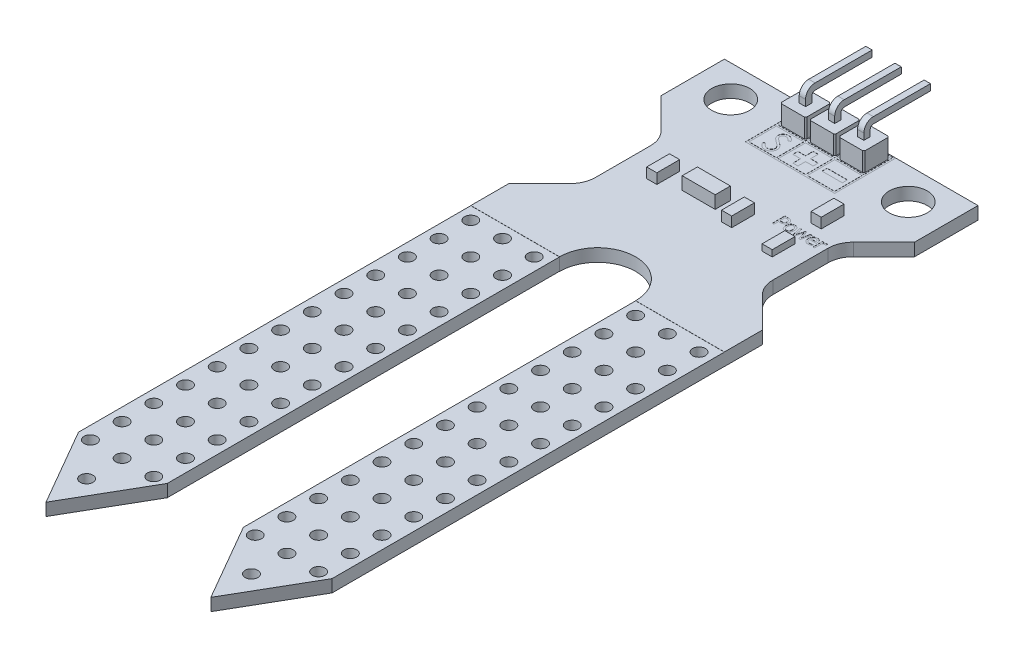
from build123d import *

# Parameters (mm, degrees)
BASE_DEPTH           = 0.5
HOLES_REACH          = 24.383
SKETCH2_R            = 1.5
PLATE_DEPTH          = 0.49
SKETCH4_R            = 0.5
PLATE_HOLES_DEPTH    = 58.879012604
SOCKET_DEPTH         = 1.5
POWER_PIN_DEPTH      = 0.25
LPATTERN2_COUNT      = 2
LPATTERN2_PITCH      = 2.3
LPATTERN2_COL_COUNT  = 2
LPATTERN2_COL_PITCH  = 2.3
SKETCH9_W            = 7.04
SKETCH9_H            = 4.74
SKETCH9_W_2          = 2.16
SKETCH9_H_2          = 2.16
SKETCH9_W_3          = 1.6
SKETCH9_H_3          = 0.4
CUT_EXTRUDE3_DEPTH   = 0.01
SKETCH10_W           = 2.6
SKETCH10_H           = 1.2
BIG_RESISTOR_DEPTH   = 1
SKETCH11_W           = 0.8
SKETCH11_H           = 1.8
SMALL_RESISTOR_DEPTH = 0.8
SKETCH12_W           = 0.8
SKETCH12_H           = 1.8
LIGHT_DEPTH          = 0.5


with BuildPart() as part:
    # Sketch1 → Base (new, symmetric)
    with BuildSketch(Plane(origin=(0, 0, 0), x_dir=(1, 0, 0), z_dir=(0, 1, 0))):
        with BuildLine():
            Line((-10, 0), (10, 0))
            Line((10, 0), (10, -5))
            Line((10, -5), (7.585786438, -7.414213562))
            ThreePointArc((7.585786438, -7.414213562), (7.152240935, -8.06306026), (7, -8.828427125))
            Line((7, -8.828427125), (7, -13.171572875))
            ThreePointArc((7, -13.171572875), (7.152240935, -13.93693974), (7.585786438, -14.585786438))
            Line((7.585786438, -14.585786438), (10, -17))
            Line((10, -17), (10, -20))
            Line((10, -20), (3, -20))
            ThreePointArc((3, -20), (0, -17), (-3, -20))
            Line((-3, -20), (-10, -20))
            Line((-10, -20), (-10, -17))
            Line((-10, -17), (-7.585786438, -14.585786438))
            ThreePointArc((-7.585786438, -14.585786438), (-7.152240935, -13.93693974), (-7, -13.171572875))
            Line((-7, -13.171572875), (-7, -8.828427125))
            ThreePointArc((-7, -8.828427125), (-7.152240935, -8.06306026), (-7.585786438, -7.414213562))
            Line((-7.585786438, -7.414213562), (-10, -5))
            Line((-10, -5), (-10, 0))
        make_face()
    extrude(amount=BASE_DEPTH, both=True)

    # Sketch2 → Holes (cut, up to next)
    with BuildSketch(Plane(origin=(0, 0.5, 0), x_dir=(1, 0, 0), z_dir=(0, 1, 0)), mode=Mode.PRIVATE) as holes_sk1:
        with Locations(Location((-7, -2.5, 0), (0, 0, 270))):
            Circle(SKETCH2_R)
    holes_tool1 = extrude(holes_sk1.sketch, amount=-HOLES_REACH, mode=Mode.PRIVATE) & part.part
    # Sketch2 → Holes (cut, up to next)
    with BuildSketch(Plane(origin=(0, 0.5, 0), x_dir=(1, 0, 0), z_dir=(0, 1, 0)), mode=Mode.PRIVATE) as holes_sk2:
        with Locations(Location((7, -2.5, 0), (0, 0, 270))):
            Circle(SKETCH2_R)
    holes_tool2 = extrude(holes_sk2.sketch, amount=-HOLES_REACH, mode=Mode.PRIVATE) & part.part
    add(holes_tool1.solids().sort_by_distance((-7, 0.5, 2.5))[0], mode=Mode.SUBTRACT)
    add(holes_tool2.solids().sort_by_distance((7, 0.5, 2.5))[0], mode=Mode.SUBTRACT)

    # Sketch3 → Plate (add, symmetric)
    with BuildSketch(Plane(origin=(0, 0, 0), x_dir=(1, 0, 0), z_dir=(0, 1, 0))):
        Polygon((-10, -20), (-3, -20), (-3, -50.937822174), (-6.5, -57), (-10, -50.937822174), align=None)
        Polygon((3, -50.937822174), (3, -20), (10, -20), (10, -50.937822174), (6.5, -57), align=None)
    extrude(amount=PLATE_DEPTH, both=True)

    # Sketch4 → Plate holes (cut, through all)
    with BuildSketch(Plane(origin=(0, 0.49, 0), x_dir=(1, 0, 0), z_dir=(0, 1, 0))):
        with Locations(Location((-9, -21, 0), (0, 0, 270))):
            Circle(SKETCH4_R)
        with Locations(Location((-6.5, -21, 0), (0, 0, 270))):
            Circle(SKETCH4_R)
        with Locations(Location((-4, -21, 0), (0, 0, 270))):
            Circle(SKETCH4_R)
        with Locations(Location((-6.5, -23.5, 0), (0, 0, 270))):
            Circle(SKETCH4_R)
        with Locations(Location((-4, -23.5, 0), (0, 0, 270))):
            Circle(SKETCH4_R)
        with Locations(Location((-6.5, -26, 0), (0, 0, 270))):
            Circle(SKETCH4_R)
        with Locations(Location((-4, -26, 0), (0, 0, 270))):
            Circle(SKETCH4_R)
        with Locations(Location((-6.5, -28.5, 0), (0, 0, 270))):
            Circle(SKETCH4_R)
        with Locations(Location((-4, -28.5, 0), (0, 0, 270))):
            Circle(SKETCH4_R)
        with Locations(Location((-6.5, -31, 0), (0, 0, 270))):
            Circle(SKETCH4_R)
        with Locations(Location((-4, -31, 0), (0, 0, 270))):
            Circle(SKETCH4_R)
        with Locations(Location((-6.5, -33.5, 0), (0, 0, 270))):
            Circle(SKETCH4_R)
        with Locations(Location((-4, -33.5, 0), (0, 0, 270))):
            Circle(SKETCH4_R)
        with Locations(Location((-6.5, -36, 0), (0, 0, 270))):
            Circle(SKETCH4_R)
        with Locations(Location((-4, -36, 0), (0, 0, 270))):
            Circle(SKETCH4_R)
        with Locations(Location((-6.5, -38.5, 0), (0, 0, 270))):
            Circle(SKETCH4_R)
        with Locations(Location((-4, -38.5, 0), (0, 0, 270))):
            Circle(SKETCH4_R)
        with Locations(Location((-6.5, -41, 0), (0, 0, 270))):
            Circle(SKETCH4_R)
        with Locations(Location((-4, -41, 0), (0, 0, 270))):
            Circle(SKETCH4_R)
        with Locations(Location((-6.5, -43.5, 0), (0, 0, 270))):
            Circle(SKETCH4_R)
        with Locations(Location((-4, -43.5, 0), (0, 0, 270))):
            Circle(SKETCH4_R)
        with Locations(Location((-6.5, -46, 0), (0, 0, 270))):
            Circle(SKETCH4_R)
        with Locations(Location((-4, -46, 0), (0, 0, 270))):
            Circle(SKETCH4_R)
        with Locations(Location((-6.5, -48.5, 0), (0, 0, 270))):
            Circle(SKETCH4_R)
        with Locations(Location((-4, -48.5, 0), (0, 0, 270))):
            Circle(SKETCH4_R)
        with Locations(Location((-6.5, -51, 0), (0, 0, 270))):
            Circle(SKETCH4_R)
        with Locations(Location((-4, -51, 0), (0, 0, 270))):
            Circle(SKETCH4_R)
        with Locations(Location((-9, -23.5, 0), (0, 0, 270))):
            Circle(SKETCH4_R)
        with Locations(Location((-9, -26, 0), (0, 0, 270))):
            Circle(SKETCH4_R)
        with Locations(Location((-9, -28.5, 0), (0, 0, 270))):
            Circle(SKETCH4_R)
        with Locations(Location((-9, -31, 0), (0, 0, 270))):
            Circle(SKETCH4_R)
        with Locations(Location((-9, -33.5, 0), (0, 0, 270))):
            Circle(SKETCH4_R)
        with Locations(Location((-9, -36, 0), (0, 0, 270))):
            Circle(SKETCH4_R)
        with Locations(Location((-9, -38.5, 0), (0, 0, 270))):
            Circle(SKETCH4_R)
        with Locations(Location((-9, -41, 0), (0, 0, 270))):
            Circle(SKETCH4_R)
        with Locations(Location((-9, -43.5, 0), (0, 0, 270))):
            Circle(SKETCH4_R)
        with Locations(Location((-9, -46, 0), (0, 0, 270))):
            Circle(SKETCH4_R)
        with Locations(Location((-9, -48.5, 0), (0, 0, 270))):
            Circle(SKETCH4_R)
        with Locations(Location((-9, -51, 0), (0, 0, 270))):
            Circle(SKETCH4_R)
        with Locations(Location((-6.5, -53.8, 0), (0, 0, 270))):
            Circle(SKETCH4_R)
        with Locations(Location((6.5, -53.8, 0), (0, 0, 90))):
            Circle(SKETCH4_R)
        with Locations(Location((9, -51, 0), (0, 0, 90))):
            Circle(SKETCH4_R)
        with Locations(Location((9, -48.5, 0), (0, 0, 90))):
            Circle(SKETCH4_R)
        with Locations(Location((9, -46, 0), (0, 0, 90))):
            Circle(SKETCH4_R)
        with Locations(Location((9, -43.5, 0), (0, 0, 90))):
            Circle(SKETCH4_R)
        with Locations(Location((9, -41, 0), (0, 0, 90))):
            Circle(SKETCH4_R)
        with Locations(Location((9, -38.5, 0), (0, 0, 90))):
            Circle(SKETCH4_R)
        with Locations(Location((9, -36, 0), (0, 0, 90))):
            Circle(SKETCH4_R)
        with Locations(Location((9, -33.5, 0), (0, 0, 90))):
            Circle(SKETCH4_R)
        with Locations(Location((9, -31, 0), (0, 0, 90))):
            Circle(SKETCH4_R)
        with Locations(Location((9, -28.5, 0), (0, 0, 90))):
            Circle(SKETCH4_R)
        with Locations(Location((9, -26, 0), (0, 0, 90))):
            Circle(SKETCH4_R)
        with Locations(Location((9, -23.5, 0), (0, 0, 90))):
            Circle(SKETCH4_R)
        with Locations(Location((4, -51, 0), (0, 0, 90))):
            Circle(SKETCH4_R)
        with Locations(Location((6.5, -51, 0), (0, 0, 90))):
            Circle(SKETCH4_R)
        with Locations(Location((4, -48.5, 0), (0, 0, 90))):
            Circle(SKETCH4_R)
        with Locations(Location((6.5, -48.5, 0), (0, 0, 90))):
            Circle(SKETCH4_R)
        with Locations(Location((4, -46, 0), (0, 0, 90))):
            Circle(SKETCH4_R)
        with Locations(Location((6.5, -46, 0), (0, 0, 90))):
            Circle(SKETCH4_R)
        with Locations(Location((4, -43.5, 0), (0, 0, 90))):
            Circle(SKETCH4_R)
        with Locations(Location((6.5, -43.5, 0), (0, 0, 90))):
            Circle(SKETCH4_R)
        with Locations(Location((4, -41, 0), (0, 0, 90))):
            Circle(SKETCH4_R)
        with Locations(Location((6.5, -41, 0), (0, 0, 90))):
            Circle(SKETCH4_R)
        with Locations(Location((4, -38.5, 0), (0, 0, 90))):
            Circle(SKETCH4_R)
        with Locations(Location((6.5, -38.5, 0), (0, 0, 90))):
            Circle(SKETCH4_R)
        with Locations(Location((4, -36, 0), (0, 0, 90))):
            Circle(SKETCH4_R)
        with Locations(Location((6.5, -36, 0), (0, 0, 90))):
            Circle(SKETCH4_R)
        with Locations(Location((4, -33.5, 0), (0, 0, 90))):
            Circle(SKETCH4_R)
        with Locations(Location((6.5, -33.5, 0), (0, 0, 90))):
            Circle(SKETCH4_R)
        with Locations(Location((4, -31, 0), (0, 0, 90))):
            Circle(SKETCH4_R)
        with Locations(Location((6.5, -31, 0), (0, 0, 90))):
            Circle(SKETCH4_R)
        with Locations(Location((4, -28.5, 0), (0, 0, 90))):
            Circle(SKETCH4_R)
        with Locations(Location((6.5, -28.5, 0), (0, 0, 90))):
            Circle(SKETCH4_R)
        with Locations(Location((4, -26, 0), (0, 0, 90))):
            Circle(SKETCH4_R)
        with Locations(Location((6.5, -26, 0), (0, 0, 90))):
            Circle(SKETCH4_R)
        with Locations(Location((4, -23.5, 0), (0, 0, 90))):
            Circle(SKETCH4_R)
        with Locations(Location((6.5, -23.5, 0), (0, 0, 90))):
            Circle(SKETCH4_R)
        with Locations(Location((4, -21, 0), (0, 0, 90))):
            Circle(SKETCH4_R)
        with Locations(Location((6.5, -21, 0), (0, 0, 90))):
            Circle(SKETCH4_R)
        with Locations(Location((9, -21, 0), (0, 0, 90))):
            Circle(SKETCH4_R)
    extrude(amount=-PLATE_HOLES_DEPTH, mode=Mode.SUBTRACT)

    # Sketch5 → Socket (add)
    with BuildSketch(Plane(origin=(0, 0.5, 0), x_dir=(1, 0, 0), z_dir=(0, 1, 0))):
        Polygon((-3.2, -0.3), (-3.3, -0.4), (-3.3, -2.2), (-3.2, -2.3), (-1.4, -2.3), (-1.3, -2.2), (-1.3, -0.4), (-1.4, -0.3), align=None)
        Polygon((-0.9, -0.3), (-1, -0.4), (-1, -2.2), (-0.9, -2.3), (0.9, -2.3), (1, -2.2), (1, -0.4), (0.9, -0.3), align=None)
        Polygon((1.4, -0.3), (1.3, -0.4), (1.3, -2.2), (1.4, -2.3), (3.2, -2.3), (3.3, -2.2), (3.3, -0.4), (3.2, -0.3), align=None)
    extrude(amount=SOCKET_DEPTH)

    # Sketch7 → Power pin (add, symmetric)
    with BuildSketch(Plane(origin=(0, 0, 0), x_dir=(0, 0, -1), z_dir=(1, 0, 0))):
        with BuildLine():
            Line((-1.05, 2), (-1.05, 2.5))
            ThreePointArc((-1.05, 2.5), (-0.976776695, 2.676776695), (-0.8, 2.75))
            Line((-0.8, 2.75), (3.7, 2.75))
            Line((3.7, 2.75), (3.7, 3.25))
            Line((3.7, 3.25), (-0.8, 3.25))
            ThreePointArc((-0.8, 3.25), (-1.330330086, 3.030330086), (-1.55, 2.5))
            Line((-1.55, 2.5), (-1.55, 2))
            Line((-1.55, 2), (-1.05, 2))
        make_face()
    power_pin = extrude(amount=POWER_PIN_DEPTH, both=True)

    # LPattern2: Power pin ×2
    with Locations(*[(i * LPATTERN2_PITCH, 0, 0) for i in range(1, LPATTERN2_COUNT)]):
        add(power_pin)

    # LPattern2 col: Power pin ×2
    with Locations(*[(-i * LPATTERN2_COL_PITCH, 0, 0) for i in range(1, LPATTERN2_COL_COUNT)]):
        add(power_pin)

    # Sketch9 → Cut-Extrude3 (cut)
    # profile 1 of 9: a face of its own
    with BuildSketch(Plane(origin=(0, 0.5, 0), x_dir=(1, 0, 0), z_dir=(0, 1, 0))):
        with Locations((0, -2.45)):
            Rectangle(SKETCH9_W, SKETCH9_H)
        with Locations((-2.3, -3.6)):
            Rectangle(SKETCH9_W_2, SKETCH9_H_2, mode=Mode.SUBTRACT)
        with Locations((2.3, -3.6)):
            Rectangle(SKETCH9_W_2, SKETCH9_H_2, mode=Mode.SUBTRACT)
        with Locations((0, -3.6)):
            Rectangle(SKETCH9_W_2, SKETCH9_H_2, mode=Mode.SUBTRACT)
        with Locations((2.3, -1.3)):
            Rectangle(SKETCH9_W_2, SKETCH9_H_2, mode=Mode.SUBTRACT)
        with Locations((0, -1.3)):
            Rectangle(SKETCH9_W_2, SKETCH9_H_2, mode=Mode.SUBTRACT)
        with Locations((-2.3, -1.3)):
            Rectangle(SKETCH9_W_2, SKETCH9_H_2, mode=Mode.SUBTRACT)
    # profile 2 of 9: a face of its own
    with BuildSketch(Plane(origin=(0, 0.5, 0), x_dir=(1, 0, 0), z_dir=(0, 1, 0))):
        Polygon((0.2, -3.8), (0.2, -4.4), (-0.2, -4.4), (-0.2, -3.8), (-0.8, -3.8), (-0.8, -3.4), (-0.2, -3.4), (-0.2, -2.8), (0.2, -2.8), (0.2, -3.4), (0.8, -3.4), (0.8, -3.8), align=None)
    # profile 3 of 9: a face of its own
    with BuildSketch(Plane(origin=(0, 0.5, 0), x_dir=(1, 0, 0), z_dir=(0, 1, 0))):
        with Locations((2.3, -3.6)):
            Rectangle(SKETCH9_W_3, SKETCH9_H_3)
    # profile 4 of 9: a face of its own
    with BuildSketch(Plane(origin=(0, 0.5, 0), x_dir=(1, 0, 0), z_dir=(0, 1, 0))):
        with BuildLine():
            add(Edge.make_bspline(
                [(-2.246490385, -4.576153846), (-2.273532617, -4.576315645), (-2.313654059, -4.573047968), (-2.366227141, -4.564203593), (-2.404086372, -4.553842087), (-2.441134062, -4.54125028), (-2.477209816, -4.525751551), (-2.512330919, -4.507176722), (-2.546694255, -4.485939358), (-2.58021238, -4.461223914), (-2.612571051, -4.432437596), (-2.644831422, -4.400374008), (-2.676043505, -4.364163602), (-2.706829687, -4.324386751), (-2.747659195, -4.264495287), (-2.775757513, -4.216295891), (-2.793846154, -4.182764423)],
                knots=[0, 0, 0, 0, 0.11369606, 0.169177916, 0.224159217, 0.278719878, 0.333794217, 0.389241459, 0.445822073, 0.503704281, 0.564293892, 0.627975416, 0.69503826, 0.765372726, 0.839611443, 1, 1, 1, 1], degree=3))
            Line((-2.793846154, -4.182764423), (-2.641682692, -4.091538462))
            add(Edge.make_bspline(
                [(-2.641682692, -4.091538462), (-2.615333113, -4.137281357), (-2.573720129, -4.20142962), (-2.508305323, -4.274072684), (-2.459465517, -4.316713706), (-2.408925617, -4.350224043), (-2.339499767, -4.381822359), (-2.283518044, -4.391635907), (-2.246490385, -4.391538462)],
                knots=[0, 0, 0, 0, 0.3046461, 0.438546905, 0.562322299, 0.677432543, 0.786897393, 1, 1, 1, 1], degree=3))
            add(Edge.make_bspline(
                [(-2.246490385, -4.391538462), (-2.215186191, -4.391820786), (-2.168541844, -4.386320718), (-2.108627287, -4.368972193), (-2.066142471, -4.350573946), (-2.026493488, -4.32827934), (-1.991723956, -4.301359985), (-1.961667208, -4.271219408), (-1.937075124, -4.237593574), (-1.918227568, -4.20143252), (-1.898856875, -4.152032077), (-1.894321716, -4.112425622), (-1.893846154, -4.086490385)],
                knots=[0, 0, 0, 0, 0.180930311, 0.27008822, 0.360156133, 0.448342532, 0.532665842, 0.613833704, 0.693981527, 0.772715977, 0.849335172, 1, 1, 1, 1], degree=3))
            add(Edge.make_bspline(
                [(-1.893846154, -4.086490385), (-1.893676765, -4.055991813), (-1.905960341, -3.99236022), (-1.938768022, -3.936635259), (-1.958389423, -3.909807692)],
                knots=[0, 0, 0, 0, 0.477158319, 1, 1, 1, 1], degree=3))
            add(Edge.make_bspline(
                [(-1.958389423, -3.909807692), (-1.974979405, -3.887924698), (-2.003044983, -3.854740657), (-2.046593296, -3.812409427), (-2.084590972, -3.776886112), (-2.127862178, -3.740740402), (-2.193103704, -3.687488516), (-2.246255026, -3.649200638), (-2.282908654, -3.622788462)],
                knots=[0, 0, 0, 0, 0.189529918, 0.299197872, 0.418925887, 0.548376285, 0.68813637, 1, 1, 1, 1], degree=3))
            add(Edge.make_bspline(
                [(-2.282908654, -3.622788462), (-2.319332486, -3.597298459), (-2.370311348, -3.559474956), (-2.433967391, -3.510236121), (-2.473696699, -3.478200971), (-2.507834061, -3.449097245), (-2.543316445, -3.417339903), (-2.565438588, -3.393305532), (-2.577860577, -3.377956731)],
                knots=[0, 0, 0, 0, 0.347081672, 0.495567816, 0.628357302, 0.74551967, 0.845830751, 1, 1, 1, 1], degree=3))
            add(Edge.make_bspline(
                [(-2.577860577, -3.377956731), (-2.593776531, -3.357350823), (-2.615964811, -3.325716744), (-2.639676206, -3.280617496), (-2.653448515, -3.246424078), (-2.665023886, -3.21184492), (-2.675502407, -3.164553806), (-2.678598853, -3.128201284), (-2.678461538, -3.103918269)],
                knots=[0, 0, 0, 0, 0.262558979, 0.388264447, 0.512667355, 0.63372227, 0.75539386, 1, 1, 1, 1], degree=3))
            add(Edge.make_bspline(
                [(-2.678461538, -3.103918269), (-2.678553734, -3.066252593), (-2.671447507, -3.010220346), (-2.647478206, -2.939595989), (-2.62266971, -2.890054956), (-2.590643888, -2.84481532), (-2.55359371, -2.803356628), (-2.509461666, -2.768505533), (-2.461039929, -2.738048494), (-2.408041541, -2.714232988), (-2.333433939, -2.689984634), (-2.274246585, -2.68435437), (-2.234951923, -2.683846154)],
                knots=[0, 0, 0, 0, 0.165779888, 0.246280008, 0.327460928, 0.408796954, 0.489715241, 0.571376032, 0.655523321, 0.741019483, 0.826546761, 1, 1, 1, 1], degree=3))
            add(Edge.make_bspline(
                [(-2.234951923, -2.683846154), (-2.192822847, -2.683778289), (-2.129561237, -2.691525523), (-2.049769386, -2.719640703), (-2.001713874, -2.743365307), (-1.964102617, -2.767094216), (-1.935419451, -2.788703433), (-1.906353652, -2.813582569), (-1.876668732, -2.841794847), (-1.846876235, -2.873605751), (-1.805150747, -2.921908707), (-1.774984467, -2.960923517), (-1.755384615, -2.988533654)],
                knots=[0, 0, 0, 0, 0.213251813, 0.318830447, 0.426793531, 0.483645951, 0.543603822, 0.60830765, 0.67712676, 0.750685636, 0.828713418, 1, 1, 1, 1], degree=3))
            Line((-1.755384615, -2.988533654), (-1.901418269, -3.099230769))
            add(Edge.make_bspline(
                [(-1.901418269, -3.099230769), (-1.918152053, -3.077154577), (-1.943547889, -3.046203482), (-1.977300729, -3.007374607), (-2.001237063, -2.983063683), (-2.023554691, -2.961103375), (-2.045214679, -2.942300853), (-2.065906655, -2.92647406), (-2.091989734, -2.909580502), (-2.124758085, -2.892855124), (-2.179943857, -2.873750803), (-2.223743197, -2.868638568), (-2.252980769, -2.868461538)],
                knots=[0, 0, 0, 0, 0.189629101, 0.274184089, 0.352183161, 0.423198873, 0.488550946, 0.548473346, 0.601440164, 0.701198082, 0.799591802, 1, 1, 1, 1], degree=3))
            add(Edge.make_bspline(
                [(-2.252980769, -2.868461538), (-2.288760118, -2.86794829), (-2.341326045, -2.875600288), (-2.404161728, -2.904100386), (-2.443540668, -2.93303211), (-2.476282849, -2.967351191), (-2.508192012, -3.020207311), (-2.51686998, -3.066044557), (-2.516923077, -3.096346154)],
                knots=[0, 0, 0, 0, 0.275902964, 0.402370856, 0.528413645, 0.650356379, 0.765895086, 1, 1, 1, 1], degree=3))
            add(Edge.make_bspline(
                [(-2.516923077, -3.096346154), (-2.517539684, -3.115722128), (-2.513143133, -3.144479643), (-2.503403158, -3.182255061), (-2.491936029, -3.210503374), (-2.476063781, -3.239039588), (-2.446620415, -3.280532441), (-2.418546908, -3.309399632), (-2.398293269, -3.328918269)],
                knots=[0, 0, 0, 0, 0.214745861, 0.32293856, 0.434116163, 0.553412311, 0.686072985, 1, 1, 1, 1], degree=3))
            add(Edge.make_bspline(
                [(-2.398293269, -3.328918269), (-2.389042289, -3.337396199), (-2.372125001, -3.35132235), (-2.345275359, -3.371329108), (-2.31778666, -3.392209601), (-2.284886018, -3.416419074), (-2.230365405, -3.455214082), (-2.187146804, -3.486462007), (-2.156346154, -3.508125)],
                knots=[0, 0, 0, 0, 0.124951974, 0.218093899, 0.333502411, 0.468789179, 0.624937586, 1, 1, 1, 1], degree=3))
            add(Edge.make_bspline(
                [(-2.156346154, -3.508125), (-2.118469517, -3.535564261), (-2.063761069, -3.575795807), (-1.996356754, -3.63167221), (-1.952403412, -3.670950709), (-1.912867071, -3.708765499), (-1.878184215, -3.745569323), (-1.848004854, -3.781099122), (-1.815504812, -3.826650485), (-1.782356478, -3.882596668), (-1.744802823, -3.972233355), (-1.732343451, -4.042695168), (-1.732307692, -4.089014423)],
                knots=[0, 0, 0, 0, 0.187773439, 0.272396139, 0.351320997, 0.424334774, 0.491908784, 0.55423322, 0.611267658, 0.716347845, 0.814540086, 1, 1, 1, 1], degree=3))
            add(Edge.make_bspline(
                [(-1.732307692, -4.089014423), (-1.73180834, -4.121010342), (-1.737031862, -4.168370829), (-1.752300775, -4.229625604), (-1.76926769, -4.273294873), (-1.790011741, -4.315849132), (-1.816324044, -4.356173249), (-1.84682563, -4.395159376), (-1.881814286, -4.431768058), (-1.920100785, -4.46537458), (-1.960566684, -4.495269858), (-2.003278223, -4.520195214), (-2.048003875, -4.540540115), (-2.094753202, -4.556431906), (-2.160627295, -4.572091465), (-2.211953075, -4.576287109), (-2.246490385, -4.576153846)],
                knots=[0, 0, 0, 0, 0.121774528, 0.18091956, 0.240256115, 0.300114444, 0.361145948, 0.423500582, 0.488669361, 0.553954105, 0.617581261, 0.680238427, 0.742187389, 0.804663212, 0.868258989, 1, 1, 1, 1], degree=3))
        make_face()
    # profile 5 of 9: a face of its own
    with BuildSketch(Plane(origin=(0, 0.5, 0), x_dir=(1, 0, 0), z_dir=(0, 1, 0))):
        with BuildLine():
            add(Edge.make_bspline(
                [(3.614912975, -8.391520479), (3.633163899, -8.404040768), (3.658411823, -8.425948178), (3.685654097, -8.46087403), (3.703330738, -8.48928983), (3.717341928, -8.520703016), (3.730875146, -8.568320938), (3.734174902, -8.606496516), (3.734177215, -8.632620163)],
                knots=[0, 0, 0, 0, 0.236652735, 0.354095324, 0.472428991, 0.593574989, 0.720487505, 1, 1, 1, 1], degree=3))
            add(Edge.make_bspline(
                [(3.734177215, -8.632620163), (3.734440026, -8.65413018), (3.73119797, -8.686086104), (3.721473566, -8.727478688), (3.711089093, -8.757085204), (3.698453563, -8.785275409), (3.678015797, -8.819787273), (3.659487713, -8.843157966), (3.645371835, -8.856908137)],
                knots=[0, 0, 0, 0, 0.260381683, 0.387741643, 0.51462425, 0.640165698, 0.76161061, 1, 1, 1, 1], degree=3))
            add(Edge.make_bspline(
                [(3.645371835, -8.856908137), (3.628222596, -8.874168407), (3.59926142, -8.896823181), (3.556438332, -8.920876751), (3.521585919, -8.935975104), (3.483093971, -8.94749291), (3.423362636, -8.958938368), (3.375658725, -8.96133288), (3.342563291, -8.961338517)],
                knots=[0, 0, 0, 0, 0.221351823, 0.332954221, 0.446758858, 0.566651796, 0.698228055, 1, 1, 1, 1], degree=3))
            Line((3.342563291, -8.961338517), (3.227848101, -8.961338517))
            Line((3.227848101, -8.961338517), (3.227848101, -9.328427125))
            Line((3.227848101, -9.328427125), (3.101265823, -9.328427125))
            Line((3.101265823, -9.328427125), (3.101265823, -8.328427125))
            Line((3.101265823, -8.328427125), (3.353045886, -8.328427125))
            add(Edge.make_bspline(
                [(3.353045886, -8.328427125), (3.380558098, -8.328591969), (3.420312752, -8.329842529), (3.470780842, -8.336395884), (3.504037276, -8.342925648), (3.534802149, -8.351368673), (3.572563912, -8.365779841), (3.598766283, -8.380299011), (3.614912975, -8.391520479)],
                knots=[0, 0, 0, 0, 0.30181566, 0.435226341, 0.557564183, 0.673137959, 0.784559398, 1, 1, 1, 1], degree=3))
        make_face()
        with BuildLine():
            add(Edge.make_bspline(
                [(3.537381329, -8.786892315), (3.547149877, -8.777187217), (3.559916605, -8.76124491), (3.573428862, -8.738111904), (3.581476261, -8.720221024), (3.587667462, -8.701198951), (3.59357476, -8.673078574), (3.594986766, -8.650929826), (3.594936709, -8.63578472)],
                knots=[0, 0, 0, 0, 0.248145665, 0.366464644, 0.482520177, 0.601375968, 0.726646544, 1, 1, 1, 1], degree=3))
            add(Edge.make_bspline(
                [(3.594936709, -8.63578472), (3.594789738, -8.619309561), (3.593083931, -8.595126144), (3.585163427, -8.564773287), (3.577223407, -8.544346049), (3.566984326, -8.525610525), (3.549606752, -8.503120705), (3.533738054, -8.488717261), (3.521558544, -8.481116998)],
                knots=[0, 0, 0, 0, 0.276790802, 0.403639623, 0.524779878, 0.643555797, 0.76031789, 1, 1, 1, 1], degree=3))
            add(Edge.make_bspline(
                [(3.521558544, -8.481116998), (3.51078644, -8.473587721), (3.492737769, -8.464957834), (3.467187336, -8.455966479), (3.446090507, -8.450902768), (3.423168412, -8.446938897), (3.387698148, -8.443119788), (3.35971181, -8.442515837), (3.340189873, -8.442351175)],
                knots=[0, 0, 0, 0, 0.208675435, 0.31773578, 0.431465043, 0.554188898, 0.688523325, 1, 1, 1, 1], degree=3))
            Line((3.340189873, -8.442351175), (3.227848101, -8.442351175))
            Line((3.227848101, -8.442351175), (3.227848101, -8.847414467))
            Line((3.227848101, -8.847414467), (3.320213608, -8.847414467))
            add(Edge.make_bspline(
                [(3.320213608, -8.847414467), (3.345029006, -8.847498782), (3.38040532, -8.846178554), (3.424687105, -8.840438303), (3.452502513, -8.834843592), (3.477307912, -8.826876615), (3.50692572, -8.813034705), (3.5261344, -8.798096919), (3.537381329, -8.786892315)],
                knots=[0, 0, 0, 0, 0.321498886, 0.457598653, 0.578008104, 0.688449725, 0.794251854, 1, 1, 1, 1], degree=3))
        make_face(mode=Mode.SUBTRACT)
    # profile 6 of 9: a face of its own
    with BuildSketch(Plane(origin=(0, 0.5, 0), x_dir=(1, 0, 0), z_dir=(0, 1, 0))):
        with BuildLine():
            add(Edge.make_bspline(
                [(4.133504747, -8.556275226), (4.157708908, -8.556117091), (4.193387837, -8.559333154), (4.238959054, -8.570162328), (4.270538006, -8.581757766), (4.300148249, -8.596705447), (4.327974594, -8.614764037), (4.353885805, -8.636091391), (4.377594091, -8.660673718), (4.39895468, -8.68818389), (4.417660945, -8.718477693), (4.433484694, -8.751425611), (4.446381381, -8.787075761), (4.45617346, -8.825449966), (4.465823875, -8.881619317), (4.468470297, -8.925460695), (4.46835443, -8.955404973)],
                knots=[0, 0, 0, 0, 0.123251869, 0.181667577, 0.238204524, 0.294238286, 0.350327398, 0.406885296, 0.464849193, 0.523978139, 0.584011388, 0.645910249, 0.709879935, 0.776851044, 0.847428363, 1, 1, 1, 1], degree=3))
            add(Edge.make_bspline(
                [(4.46835443, -8.955404973), (4.468440132, -8.98547689), (4.465885837, -9.029395426), (4.456156814, -9.085623055), (4.446332938, -9.123978398), (4.433584947, -9.159691752), (4.417591758, -9.192561483), (4.399016176, -9.22280112), (4.377592314, -9.250149929), (4.353816579, -9.274513371), (4.328036623, -9.295873499), (4.300130224, -9.313699076), (4.270534065, -9.328478991), (4.238918768, -9.339808627), (4.193400942, -9.350723642), (4.157701972, -9.353881609), (4.133504747, -9.35374358)],
                knots=[0, 0, 0, 0, 0.153333766, 0.223622391, 0.290633759, 0.35495793, 0.416591386, 0.476660723, 0.53556016, 0.593317841, 0.649909737, 0.705850098, 0.76176723, 0.818223218, 0.876674041, 1, 1, 1, 1], degree=3))
            add(Edge.make_bspline(
                [(4.133504747, -9.35374358), (4.10862386, -9.35402896), (4.072151508, -9.35062251), (4.025572771, -9.339483559), (3.99360707, -9.32744457), (3.963517901, -9.312446837), (3.935625885, -9.293900583), (3.909962332, -9.271901924), (3.886410802, -9.246816009), (3.865592431, -9.218691769), (3.847184896, -9.188215707), (3.831823056, -9.155224088), (3.819074417, -9.119897826), (3.809561105, -9.082095914), (3.799675387, -9.027316064), (3.797603451, -8.984525297), (3.797468354, -8.955404973)],
                knots=[0, 0, 0, 0, 0.126623541, 0.185762466, 0.243468747, 0.300244888, 0.356694258, 0.413633082, 0.472086135, 0.531600579, 0.591561601, 0.653162287, 0.716692122, 0.782593358, 0.851505953, 1, 1, 1, 1], degree=3))
            add(Edge.make_bspline(
                [(3.797468354, -8.955404973), (3.797423037, -8.925537598), (3.799842636, -8.881781943), (3.809861679, -8.825769598), (3.819893472, -8.787508369), (3.832675029, -8.751763568), (3.848828926, -8.718837531), (3.86760711, -8.688410781), (3.8892135, -8.660786294), (3.913387593, -8.636357672), (3.939329245, -8.614785477), (3.967271781, -8.596739073), (3.996865327, -8.581633766), (4.028612349, -8.57055445), (4.073859575, -8.559076903), (4.109469928, -8.556252731), (4.133504747, -8.556275226)],
                knots=[0, 0, 0, 0, 0.15215776, 0.222425985, 0.289447046, 0.353383267, 0.415396241, 0.475860313, 0.535164909, 0.593567431, 0.650568342, 0.706628112, 0.762632561, 0.819341043, 0.877480489, 1, 1, 1, 1], degree=3))
        make_face()
        with BuildLine():
            add(Edge.make_bspline(
                [(4.133504747, -9.23981953), (4.149190733, -9.239592793), (4.172332857, -9.237948067), (4.201658983, -9.230484331), (4.221583576, -9.222353296), (4.24030695, -9.212583615), (4.257528568, -9.200267482), (4.27338809, -9.185840242), (4.287657002, -9.169002746), (4.300654109, -9.150158349), (4.311666927, -9.128852398), (4.320947897, -9.105299137), (4.328617659, -9.079625684), (4.334485742, -9.051697301), (4.340475529, -9.010212923), (4.341811617, -8.977716598), (4.341772152, -8.955404973)],
                knots=[0, 0, 0, 0, 0.117813136, 0.172982909, 0.226240362, 0.278888294, 0.331025194, 0.384577959, 0.439284859, 0.496204132, 0.555922045, 0.618729177, 0.685842386, 0.756641583, 0.832586194, 1, 1, 1, 1], degree=3))
            add(Edge.make_bspline(
                [(4.341772152, -8.955404973), (4.341758263, -8.932840299), (4.340571814, -8.899987202), (4.334378981, -8.85809569), (4.328940297, -8.829889641), (4.321109067, -8.804140032), (4.311943836, -8.780594801), (4.300743037, -8.759511707), (4.28816199, -8.740550346), (4.273690216, -8.724070255), (4.258117952, -8.709395788), (4.240737102, -8.697393815), (4.222149336, -8.687302838), (4.201990968, -8.6796109), (4.172549115, -8.672035875), (4.149246557, -8.670428434), (4.133504747, -8.670199277)],
                knots=[0, 0, 0, 0, 0.168865469, 0.245063536, 0.316508225, 0.383414248, 0.446027488, 0.50512473, 0.561591387, 0.615756071, 0.668780413, 0.721159218, 0.773209917, 0.826581425, 0.8820582, 1, 1, 1, 1], degree=3))
            add(Edge.make_bspline(
                [(4.133504747, -8.670199277), (4.117703385, -8.670465531), (4.094321293, -8.671998632), (4.064766199, -8.67964518), (4.044475576, -8.68730774), (4.025707892, -8.697330803), (4.008285078, -8.709457347), (3.992534663, -8.724061473), (3.977855539, -8.740490157), (3.965267334, -8.759511868), (3.954140286, -8.780643417), (3.944584221, -8.804051171), (3.937228009, -8.829963176), (3.931344847, -8.858058504), (3.925327868, -8.900005425), (3.924021989, -8.93283022), (3.924050633, -8.955404973)],
                knots=[0, 0, 0, 0, 0.118168361, 0.173522531, 0.227235226, 0.279604634, 0.331867681, 0.385137134, 0.439505692, 0.495847557, 0.554814193, 0.61747273, 0.684091217, 0.75547806, 0.831507727, 1, 1, 1, 1], degree=3))
            add(Edge.make_bspline(
                [(3.924050633, -8.955404973), (3.924024756, -8.977321988), (3.92535849, -9.00929082), (3.931359828, -9.050246465), (3.937248928, -9.077943532), (3.944613659, -9.103652406), (3.954180601, -9.12704612), (3.965302998, -9.148370474), (3.977918899, -9.167737363), (3.992400539, -9.184744131), (4.008285518, -9.199565445), (4.025750671, -9.211861743), (4.044409584, -9.222339027), (4.064730844, -9.230220615), (4.094349603, -9.237714672), (4.117661397, -9.239769093), (4.133504747, -9.23981953)],
                knots=[0, 0, 0, 0, 0.164254543, 0.239131144, 0.309845932, 0.376264969, 0.439181651, 0.498828367, 0.556224232, 0.611937959, 0.665761022, 0.718524477, 0.771580686, 0.825693026, 0.881275248, 1, 1, 1, 1], degree=3))
        make_face(mode=Mode.SUBTRACT)
    # profile 7 of 9: a face of its own
    with BuildSketch(Plane(origin=(0, 0.5, 0), x_dir=(1, 0, 0), z_dir=(0, 1, 0))):
        Polygon((5.363132911, -8.581591682), (5.493670886, -8.581591682), (5.30715981, -9.328427125), (5.192642405, -9.328427125), (5.012658228, -8.752675542), (4.834058544, -9.328427125), (4.720134494, -9.328427125), (4.53164557, -8.581591682), (4.662183544, -8.581591682), (4.790545886, -9.159914467), (4.965189873, -8.581591682), (5.06744462, -8.581591682), (5.246637658, -9.159914467), align=None)
    # profile 8 of 9: a face of its own
    with BuildSketch(Plane(origin=(0, 0.5, 0), x_dir=(1, 0, 0), z_dir=(0, 1, 0))):
        with BuildLine():
            add(Edge.make_bspline(
                [(6.075949367, -9.320317948), (6.05385741, -9.32618504), (6.026458349, -9.333135125), (5.992680663, -9.338399823), (5.967536579, -9.340431998), (5.94766475, -9.341040745), (5.933742089, -9.341085353)],
                knots=[0, 0, 0, 0, 0.475715732, 0.586628104, 0.710510572, 1, 1, 1, 1], degree=3))
            add(Edge.make_bspline(
                [(5.933742089, -9.341085353), (5.905474404, -9.341201841), (5.864108178, -9.338115877), (5.81108863, -9.327862759), (5.774973536, -9.316657943), (5.741180178, -9.302671822), (5.710074836, -9.285145726), (5.681331361, -9.26469597), (5.655322015, -9.241043517), (5.632171656, -9.214445099), (5.611804399, -9.185204616), (5.594784777, -9.153164949), (5.580969269, -9.118507636), (5.570030856, -9.081310308), (5.559586309, -9.026636458), (5.557074731, -8.983829812), (5.556962025, -8.954613834)],
                knots=[0, 0, 0, 0, 0.138010658, 0.202054972, 0.263380769, 0.322416081, 0.380379619, 0.43739781, 0.494395079, 0.551685478, 0.60930803, 0.668092451, 0.728494619, 0.791269632, 0.857209837, 1, 1, 1, 1], degree=3))
            add(Edge.make_bspline(
                [(5.556962025, -8.954613834), (5.557232101, -8.925681656), (5.559448729, -8.883130939), (5.569737975, -8.828631505), (5.580222255, -8.791028121), (5.593645603, -8.755694621), (5.610112635, -8.72267673), (5.629582771, -8.692038907), (5.651940911, -8.663941121), (5.676767708, -8.63871778), (5.703589263, -8.616596947), (5.732279337, -8.597829568), (5.762806346, -8.582551037), (5.795292867, -8.570830279), (5.841732555, -8.559229737), (5.878267994, -8.556507808), (5.902887658, -8.556275226)],
                knots=[0, 0, 0, 0, 0.146258879, 0.214368307, 0.27972423, 0.343167653, 0.40496197, 0.465738786, 0.52616162, 0.585963884, 0.644155795, 0.701412426, 0.758739684, 0.816144242, 0.875498069, 1, 1, 1, 1], degree=3))
            add(Edge.make_bspline(
                [(5.902887658, -8.556275226), (5.924777883, -8.556211752), (5.956941739, -8.558332451), (5.997842371, -8.566989844), (6.025903052, -8.57562061), (6.051943559, -8.587288455), (6.084977422, -8.606002691), (6.106360273, -8.625171823), (6.11965981, -8.638751492)],
                knots=[0, 0, 0, 0, 0.275080864, 0.402883192, 0.52439118, 0.643012812, 0.76060413, 1, 1, 1, 1], degree=3))
            add(Edge.make_bspline(
                [(6.11965981, -8.638751492), (6.133511229, -8.652884347), (6.151018932, -8.677357611), (6.16999828, -8.713287756), (6.181893618, -8.743173351), (6.191228135, -8.776031062), (6.200461371, -8.826216214), (6.202380009, -8.866023237), (6.202531646, -8.893498327)],
                knots=[0, 0, 0, 0, 0.215475753, 0.326952257, 0.443317595, 0.566199288, 0.699558736, 1, 1, 1, 1], degree=3))
            Line((6.202531646, -8.893498327), (6.202531646, -8.961338517))
            Line((6.202531646, -8.961338517), (5.683544304, -8.961338517))
            add(Edge.make_bspline(
                [(5.683544304, -8.961338517), (5.683439481, -8.981703424), (5.685329947, -9.011438152), (5.692383458, -9.049408441), (5.699384009, -9.075231724), (5.708736963, -9.099068361), (5.720047792, -9.121069467), (5.733530411, -9.14111378), (5.749053186, -9.159172715), (5.766297325, -9.175322374), (5.785366748, -9.189148439), (5.805948664, -9.200886607), (5.827953685, -9.210701828), (5.851771036, -9.217937631), (5.88630634, -9.225137647), (5.913346072, -9.227420462), (5.931764241, -9.227161302)],
                knots=[0, 0, 0, 0, 0.147679992, 0.215278435, 0.27976099, 0.341367416, 0.40059095, 0.458794788, 0.516088517, 0.572911673, 0.629706672, 0.686449342, 0.744450636, 0.804022337, 0.866556501, 1, 1, 1, 1], degree=3))
            add(Edge.make_bspline(
                [(5.931764241, -9.227161302), (5.959133356, -9.227017292), (6.01198493, -9.221300892), (6.062284141, -9.204325906), (6.085640823, -9.194329023)],
                knots=[0, 0, 0, 0, 0.518474067, 1, 1, 1, 1], degree=3))
            add(Edge.make_bspline(
                [(6.085640823, -9.194329023), (6.105342705, -9.185627697), (6.13916581, -9.169419984), (6.17003926, -9.148200749), (6.18255538, -9.138553707)],
                knots=[0, 0, 0, 0, 0.577022489, 1, 1, 1, 1], degree=3))
            Line((6.18255538, -9.138553707), (6.189873418, -9.138553707))
            Line((6.189873418, -9.138553707), (6.189873418, -9.278189783))
            add(Edge.make_bspline(
                [(6.189873418, -9.278189783), (6.181619002, -9.281386232), (6.168562873, -9.286522443), (6.150239701, -9.293788263), (6.120886915, -9.305633192), (6.096043586, -9.314862744), (6.075949367, -9.320317948)],
                knots=[0, 0, 0, 0, 0.218524391, 0.346371859, 0.48661077, 1, 1, 1, 1], degree=3))
        make_face()
        with BuildLine():
            add(Edge.make_bspline(
                [(5.74465981, -8.715096429), (5.73547302, -8.724331389), (5.723470228, -8.739553642), (5.709890955, -8.761396236), (5.701881814, -8.778813401), (5.694954945, -8.797132805), (5.688215712, -8.824247913), (5.684405365, -8.845365258), (5.683544304, -8.860072694)],
                knots=[0, 0, 0, 0, 0.242625143, 0.360813104, 0.479167518, 0.599865812, 0.725825642, 1, 1, 1, 1], degree=3))
            Line((5.683544304, -8.860072694), (6.075949367, -8.860072694))
            add(Edge.make_bspline(
                [(6.075949367, -8.860072694), (6.075762026, -8.844572214), (6.073777104, -8.822251916), (6.069002859, -8.793782047), (6.064141677, -8.774925911), (6.05862126, -8.75738918), (6.049018557, -8.736616949), (6.040604765, -8.722078563), (6.033425633, -8.713711935)],
                knots=[0, 0, 0, 0, 0.29959835, 0.432961907, 0.557937652, 0.676115927, 0.788008182, 1, 1, 1, 1], degree=3))
            add(Edge.make_bspline(
                [(6.033425633, -8.713711935), (6.02621831, -8.704616624), (6.0134895, -8.692414538), (5.993726282, -8.679445338), (5.977110388, -8.671575862), (5.958857219, -8.665113532), (5.930663361, -8.658863619), (5.908121839, -8.657802009), (5.892602848, -8.657541049)],
                knots=[0, 0, 0, 0, 0.22124963, 0.334031027, 0.450019854, 0.57145547, 0.703086283, 1, 1, 1, 1], degree=3))
            add(Edge.make_bspline(
                [(5.892602848, -8.657541049), (5.877236141, -8.657544839), (5.854910837, -8.659255698), (5.826652757, -8.665280191), (5.808038221, -8.672006395), (5.790733231, -8.680205782), (5.768888756, -8.693641518), (5.753836624, -8.705881992), (5.74465981, -8.715096429)],
                knots=[0, 0, 0, 0, 0.282218054, 0.410057475, 0.529592748, 0.644999803, 0.7613376, 1, 1, 1, 1], degree=3))
        make_face(mode=Mode.SUBTRACT)
    # profile 9 of 9: a face of its own
    with BuildSketch(Plane(origin=(0, 0.5, 0), x_dir=(1, 0, 0), z_dir=(0, 1, 0))):
        with BuildLine():
            add(Edge.make_bspline(
                [(6.67147943, -8.581591682), (6.681038773, -8.581480032), (6.697833892, -8.581810029), (6.714412309, -8.584356777), (6.721518987, -8.585349593)],
                knots=[0, 0, 0, 0, 0.571302402, 1, 1, 1, 1], degree=3))
            Line((6.721518987, -8.585349593), (6.721518987, -8.70817396))
            Line((6.721518987, -8.70817396), (6.714992089, -8.70817396))
            add(Edge.make_bspline(
                [(6.714992089, -8.70817396), (6.705234705, -8.70817396), (6.683082806, -8.70817396), (6.660930907, -8.70817396), (6.648536392, -8.70817396)],
                knots=[0, 0, 0, 0, 0.44047619, 1, 1, 1, 1], degree=3))
            add(Edge.make_bspline(
                [(6.648536392, -8.70817396), (6.631779914, -8.708155812), (6.60642886, -8.711075999), (6.573412511, -8.720282086), (6.54862908, -8.730023694), (6.524328415, -8.742500744), (6.49207553, -8.763207448), (6.469693198, -8.782092307), (6.455696203, -8.796188201)],
                knots=[0, 0, 0, 0, 0.230943487, 0.34987543, 0.471981553, 0.597666048, 0.726081612, 1, 1, 1, 1], degree=3))
            Line((6.455696203, -8.796188201), (6.455696203, -9.328427125))
            Line((6.455696203, -9.328427125), (6.329113924, -9.328427125))
            Line((6.329113924, -9.328427125), (6.329113924, -8.581591682))
            Line((6.329113924, -8.581591682), (6.455696203, -8.581591682))
            Line((6.455696203, -8.581591682), (6.455696203, -8.69254896))
            add(Edge.make_bspline(
                [(6.455696203, -8.69254896), (6.476002121, -8.674197728), (6.505844564, -8.649383063), (6.546038829, -8.62162037), (6.572796989, -8.606739842), (6.598161799, -8.595350795), (6.630587027, -8.585181153), (6.655245798, -8.581547094), (6.67147943, -8.581591682)],
                knots=[0, 0, 0, 0, 0.330909707, 0.468650524, 0.589975009, 0.700616191, 0.804234643, 1, 1, 1, 1], degree=3))
        make_face()
    extrude(amount=-CUT_EXTRUDE3_DEPTH, mode=Mode.SUBTRACT)

    # Sketch10 → Big resistor (add)
    with BuildSketch(Plane(origin=(0, 0.5, 0), x_dir=(1, 0, 0), z_dir=(0, 1, 0))):
        with Locations((-1.4, -10.028427125)):
            Rectangle(SKETCH10_W, SKETCH10_H)
    extrude(amount=BIG_RESISTOR_DEPTH)

    # Sketch11 → Small resistor (add)
    with BuildSketch(Plane(origin=(0, 0.5, 0), x_dir=(1, 0, 0), z_dir=(0, 1, 0))):
        with Locations((1.4, -10.328427125)):
            Rectangle(SKETCH11_W, SKETCH11_H)
        with Locations((-4.5, -10.328427125)):
            Rectangle(SKETCH11_W, SKETCH11_H)
        with Locations((5.016317247, -6.881591682)):
            Rectangle(SKETCH11_W, SKETCH11_H)
    extrude(amount=SMALL_RESISTOR_DEPTH)

    # Sketch12 → Light (add)
    with BuildSketch(Plane(origin=(0, 0.5, 0), x_dir=(1, 0, 0), z_dir=(0, 1, 0))):
        with Locations((5, -10.728427125)):
            Rectangle(SKETCH12_W, SKETCH12_H)
    extrude(amount=LIGHT_DEPTH)


solid = part.part
